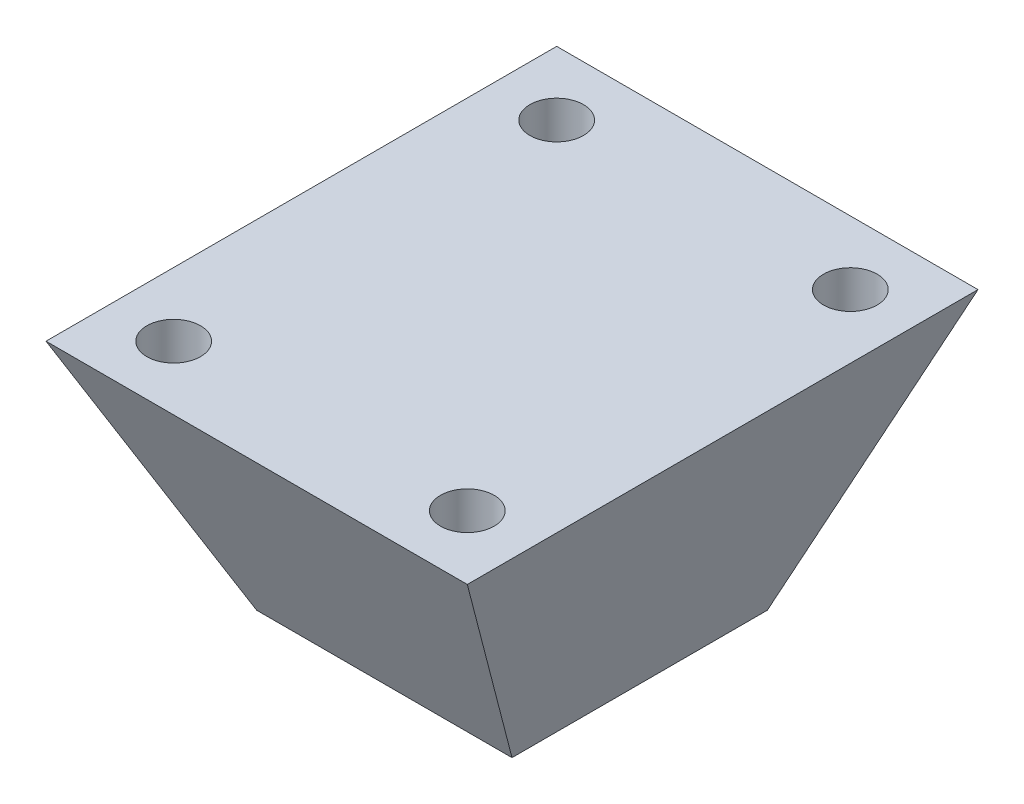
from build123d import *

# Parameters (mm, degrees)
SKETCH2_W           = 16.5
SKETCH2_H           = 40
BOSS_EXTRUDE1_DEPTH = 20
CUT_EXTRUDE1_DEPTH  = 20
SKETCH5_W           = 46.207326837
SKETCH5_H           = 41.881023155
CUT_EXTRUDE2_DEPTH  = 20
SKETCH1_R           = 2.1
CUT_EXTRUDE3_DEPTH  = 5.7
SKETCH7_R           = 2.1
CUT_EXTRUDE4_DEPTH  = 5.7


with BuildPart() as part:
    # Sketch2 → Boss-Extrude1 (new body)
    with BuildSketch(Plane(origin=(0, 20, 0), x_dir=(1, 0, 0), z_dir=(0, 1, 0))):
        with Locations((-8.25, 0)):
            Rectangle(SKETCH2_W, SKETCH2_H)
        with Locations((8.25, 0)):
            Rectangle(SKETCH2_W, SKETCH2_H)
    extrude(amount=-BOSS_EXTRUDE1_DEPTH)

    # Sketch4 → Cut-Extrude1 (cut)
    with BuildSketch(Plane(origin=(9.044657999, -2.93951385, 0), x_dir=(0, 0, 1), z_dir=(-0.9510340687309481, 0.30908607233755875, 0))):
        Polygon((-21.945163579, 1.558302269), (-22.817048797, 25.42042402), (26.491055296, 25.42042402), (24.942749687, 1.558302269), align=None)
    cut_extrude1 = extrude(amount=-CUT_EXTRUDE1_DEPTH, mode=Mode.SUBTRACT)

    # Sketch5 → Cut-Extrude2 (cut)
    with BuildSketch(Plane(origin=(0, -4, -8), x_dir=(1, 0, 0), z_dir=(0, 0.447213595499958, 0.894427190999916))):
        with Locations((1.743983375, 9.495933816)):
            Rectangle(SKETCH5_W, SKETCH5_H)
    cut_extrude2 = extrude(amount=-CUT_EXTRUDE2_DEPTH, mode=Mode.SUBTRACT)

    # Mirror1: Cut-Extrude2 across plane
    add(cut_extrude2.mirror(Plane.XY), mode=Mode.SUBTRACT)

    # Mirror2: Cut-Extrude1 across plane
    add(cut_extrude1.mirror(Plane(origin=(0, 0, 0), x_dir=(0, 0, 1), z_dir=(1, 0, 0))), mode=Mode.SUBTRACT)

    # Sketch1 → Cut-Extrude3 (cut)
    with BuildSketch(Plane(origin=(0, 0, 0), x_dir=(1, 0, 0), z_dir=(0, 1, 0))):
        with Locations(Location((-5, 5, 0), (0, 0, 270))):
            Circle(SKETCH1_R)
        with Locations(Location((5, 5, 0), (0, 0, 270))):
            Circle(SKETCH1_R)
        with Locations(Location((5, -5, 0), (0, 0, 270))):
            Circle(SKETCH1_R)
        with Locations(Location((-5, -5, 0), (0, 0, 270))):
            Circle(SKETCH1_R)
    extrude(amount=CUT_EXTRUDE3_DEPTH, mode=Mode.SUBTRACT)

    # Sketch7 → Cut-Extrude4 (cut)
    with BuildSketch(Plane(origin=(0, 20, 0), x_dir=(1, 0, 0), z_dir=(0, 1, 0))):
        with Locations(Location((-11.5, 15, 0), (0, 0, 270))):
            Circle(SKETCH7_R)
        with Locations(Location((-11.5, -15, 0), (0, 0, 90))):
            Circle(SKETCH7_R)
        with Locations(Location((11.5, -15, 0), (0, 0, 270))):
            Circle(SKETCH7_R)
        with Locations(Location((11.5, 15, 0), (0, 0, 90))):
            Circle(SKETCH7_R)
    extrude(amount=-CUT_EXTRUDE4_DEPTH, mode=Mode.SUBTRACT)


solid = part.part
